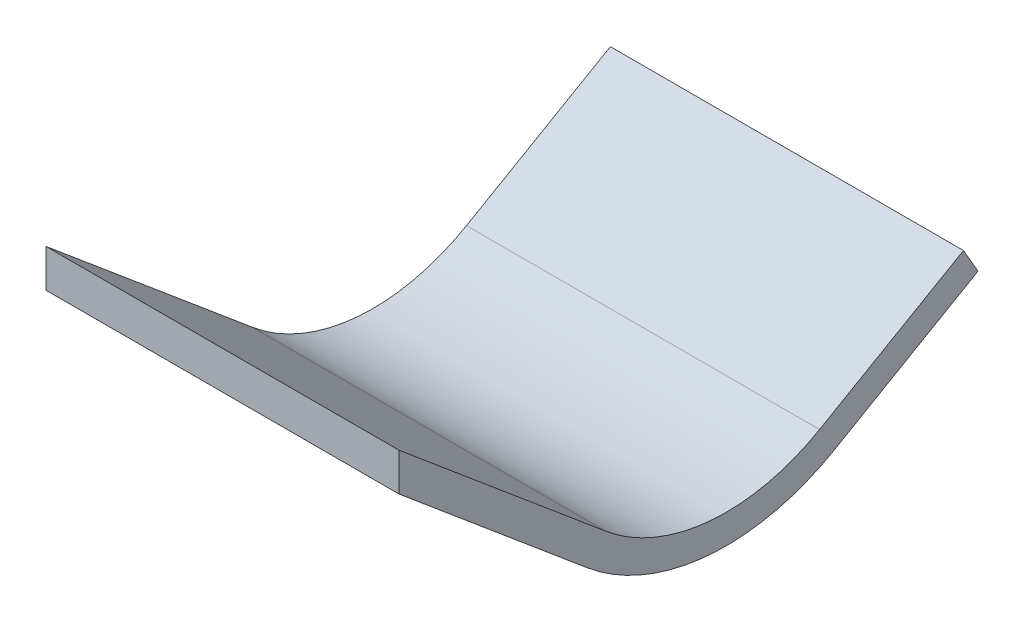
from build123d import *

# Parameters (mm, degrees)
BOSS_EXTRUDE1_DEPTH = 85


with BuildPart() as part:
    # Sketch1 → Boss-Extrude1 (new body)
    with BuildSketch(Plane(origin=(0, 0, 0), x_dir=(0, 0, -1), z_dir=(1, 0, 0))):
        with BuildLine():
            Line((-72.040887119, 10.239479838), (-22.248525122, -31.542342606))
            ThreePointArc((-22.248525122, -31.542342606), (2.754778304, -41.899419337), (29.176860582, -36.042134238))
            Line((29.176860582, -36.042134238), (63.818128902, -16.042571014))
            Line((63.818128902, -16.042571014), (67.318052467, -22.10479297))
            Line((67.318052467, -22.10479297), (32.676784146, -42.104356194))
            ThreePointArc((32.676784146, -42.104356194), (2.144600181, -48.872774531), (-26.748106001, -36.904596975))
            Line((-26.748106001, -36.904596975), (-72.040887119, 1.101532134))
            Line((-72.040887119, 1.101532134), (-72.040887119, 10.239479838))
        make_face()
    extrude(amount=BOSS_EXTRUDE1_DEPTH)


solid = part.part
